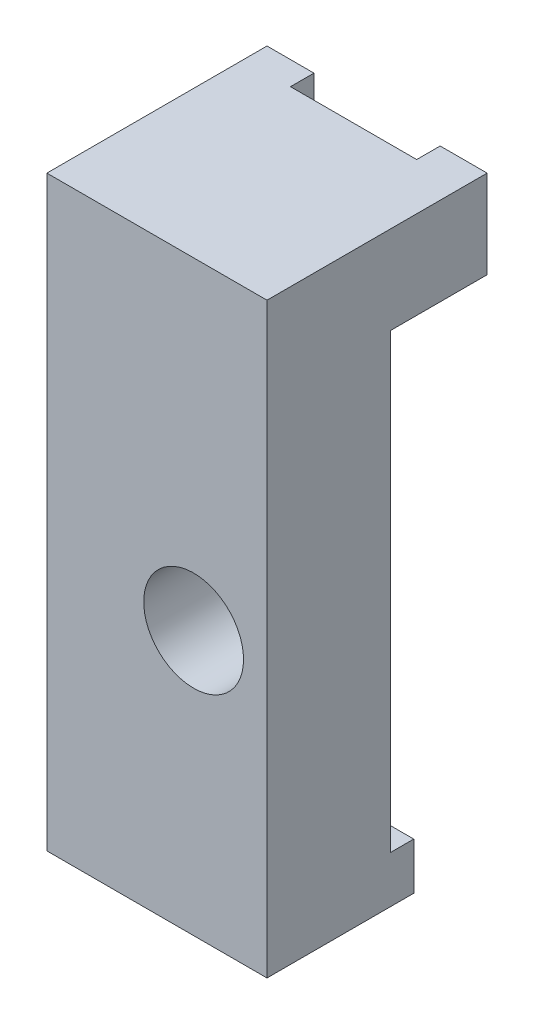
from build123d import *

# Parameters (mm, degrees)
SKETCH1_W           = 9.525
SKETCH1_H           = 25.4
BOSS_EXTRUDE1_DEPTH = 4.7625
CUT_EXTRUDE1_REACH  = 18.574
SKETCH2_W           = 3.175
SKETCH2_H           = 21.59
CUT_EXTRUDE2_REACH  = 18.574
SKETCH3_R           = 2.159
CUT_EXTRUDE3_REACH  = 28.278
SKETCH4_W           = 5.461
SKETCH4_H           = 1.016
SKETCH5_W           = 1.016
SKETCH5_H           = 19.558
CUT_EXTRUDE4_DEPTH  = 17.573986583


with BuildPart() as part:
    # Sketch1 → Boss-Extrude1 (new, symmetric)
    with BuildSketch(Plane.XY):
        Rectangle(SKETCH1_W, SKETCH1_H)
    extrude(amount=BOSS_EXTRUDE1_DEPTH, both=True)

    # Sketch2 → Cut-Extrude1 (cut, up to next)
    with BuildSketch(Plane(origin=(4.7625, 0, 0), x_dir=(0, 0, -1), z_dir=(1, 0, 0)), mode=Mode.PRIVATE) as cut_extrude1_sk1:
        with Locations((3.175, -1.905)):
            Rectangle(SKETCH2_W, SKETCH2_H)
    cut_extrude1_tool1 = extrude(cut_extrude1_sk1.sketch, amount=-CUT_EXTRUDE1_REACH, mode=Mode.PRIVATE) & part.part
    add(cut_extrude1_tool1.solids().sort_by_distance((4.7625, -1.905, -3.175))[0], mode=Mode.SUBTRACT)

    # Sketch3 → Cut-Extrude2 (cut, up to next)
    with BuildSketch(Plane.XY.offset(4.7625), mode=Mode.PRIVATE) as cut_extrude2_sk1:
        with Locations((1.5875, -1.27)):
            Circle(SKETCH3_R)
    cut_extrude2_tool1 = extrude(cut_extrude2_sk1.sketch, amount=-CUT_EXTRUDE2_REACH, mode=Mode.PRIVATE) & part.part
    add(cut_extrude2_tool1.solids().sort_by_distance((1.5875, -1.27, 4.7625))[0], mode=Mode.SUBTRACT)

    # Sketch4 → Cut-Extrude3 (cut, up to next)
    with BuildSketch(Plane(origin=(0, 12.7, 0), x_dir=(1, 0, 0), z_dir=(0, 1, 0)), mode=Mode.PRIVATE) as cut_extrude3_sk1:
        with Locations((0, 4.2545)):
            Rectangle(SKETCH4_W, SKETCH4_H)
    cut_extrude3_tool1 = extrude(cut_extrude3_sk1.sketch, amount=-CUT_EXTRUDE3_REACH, mode=Mode.PRIVATE) & part.part
    add(cut_extrude3_tool1.solids().sort_by_distance((0, 12.7, -4.2545))[0], mode=Mode.SUBTRACT)

    # Sketch5 → Cut-Extrude4 (cut, through all)
    with BuildSketch(Plane(origin=(4.7625, 0, 0), x_dir=(0, 0, -1), z_dir=(1, 0, 0))):
        with Locations((1.0795, -0.889)):
            Rectangle(SKETCH5_W, SKETCH5_H)
    extrude(amount=-CUT_EXTRUDE4_DEPTH, mode=Mode.SUBTRACT)


solid = part.part
